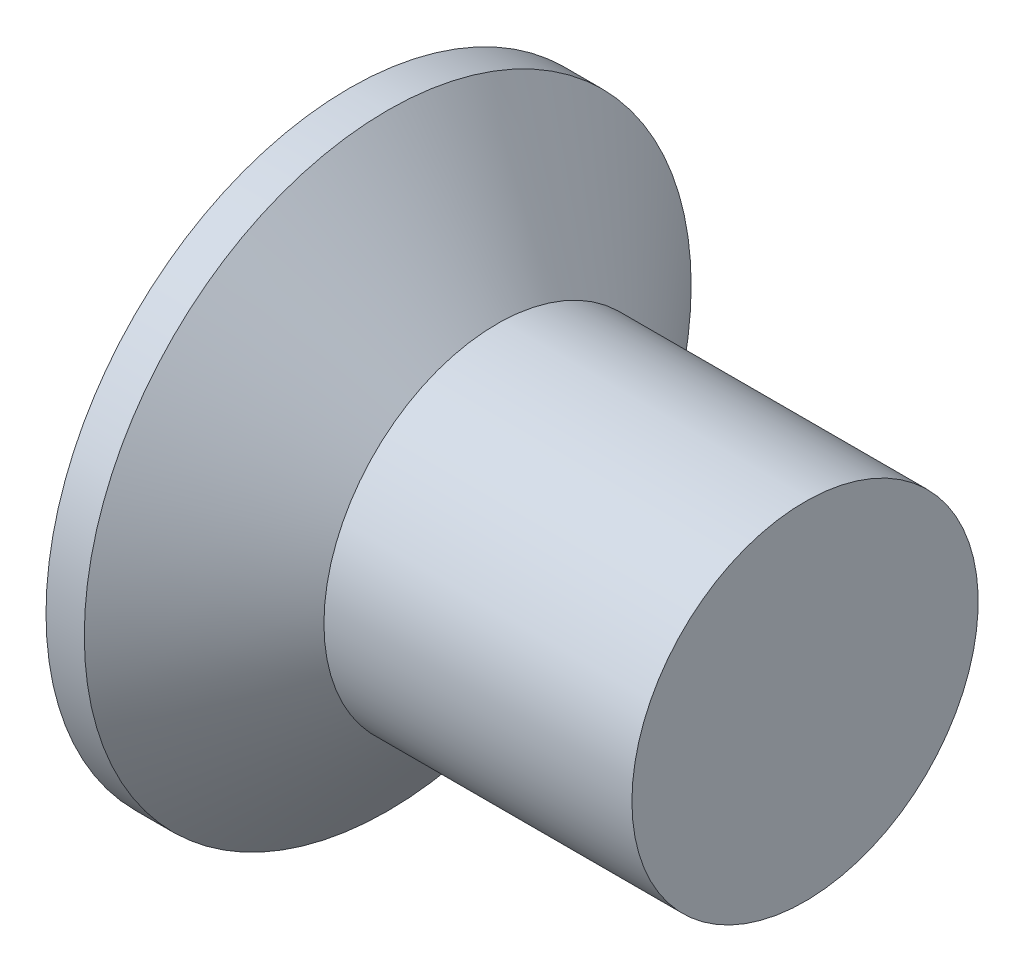
from build123d import *

# Parameters (mm, degrees)
CIRPATTERN1_COUNT = 2
CIRPATTERN1_ANGLE = 90


with BuildPart() as part:
    # BodySke → Base-Revolve (revolve)
    with BuildSketch(Plane.XY, mode=Mode.PRIVATE) as base_revolve_sk:
        Polygon((0, 0), (0, 4.2291), (0.53351116, 4.2291), (2.0574, 2.413), (6.35, 2.413), (6.35, 0), align=None)
    revolve(base_revolve_sk.sketch.rotate(Axis((-6.35, 0, 0), (1, 0, 0)), 90), axis=Axis((-6.35, 0, 0), (1, 0, 0)))

    # Sketch3 → Cross section 0
    with BuildSketch(Plane.ZY):
        with BuildLine():
            Line((-0.5334, 2.8575), (0.5334, 2.8575))
            Line((0.5334, 2.8575), (0.5334, -2.8575))
            Line((0.5334, -2.8575), (-0.5334, -2.8575))
            Line((-0.5334, -2.8575), (-0.5334, 2.8575))
        make_face()
    # Sketch4 → Cross section 1
    with BuildSketch(Plane.ZY.offset(-3.7338)):
        with BuildLine():
            Line((-0.2667, 0.2667), (0.2667, 0.2667))
            Line((0.2667, 0.2667), (0.2667, -0.2667))
            Line((0.2667, -0.2667), (-0.2667, -0.2667))
            Line((-0.2667, -0.2667), (-0.2667, 0.2667))
        make_face()
    cross = loft(mode=Mode.SUBTRACT)

    # CirPattern1: Cross ×2 about axis
    cirpattern1_axis = Axis((0, 0, 0), (1, 0, 0))
    for i in range(1, CIRPATTERN1_COUNT):
        add(cross.rotate(cirpattern1_axis, i * CIRPATTERN1_ANGLE / (CIRPATTERN1_COUNT - 1)), mode=Mode.SUBTRACT)


solid = part.part
